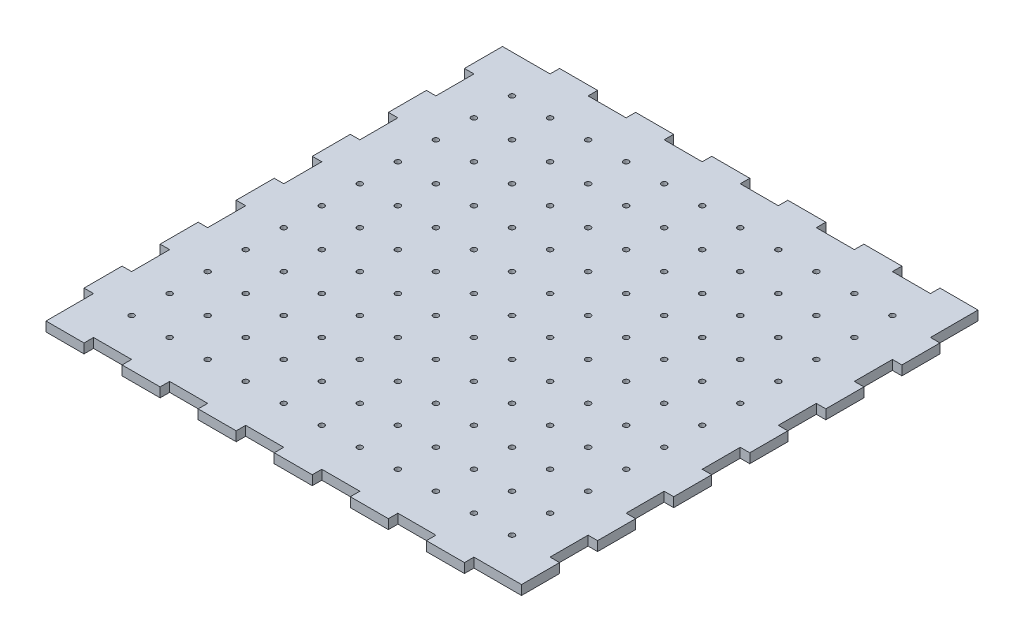
from build123d import *

# Parameters (mm, degrees)
SKETCH1_R           = 1.7907
BOSS_EXTRUDE1_DEPTH = 6.35


with BuildPart() as part:
    # Sketch1 → Boss-Extrude1 (new body)
    with BuildSketch(Plane(origin=(0, 0, 0), x_dir=(1, 0, 0), z_dir=(0, 1, 0))):
        Polygon((-65.292450766, -101.6), (-39.892450766, -101.6), (-39.892450766, -107.95), (-14.492450766, -107.95), (-14.492450766, -101.6), (10.907549234, -101.6), (10.907549234, -107.95), (36.307549234, -107.95), (36.307549234, -101.6), (61.707549234, -101.6), (61.707549234, -107.95), (87.107549234, -107.95), (87.107549234, -101.6), (112.507549234, -101.6), (112.507549234, -107.95), (137.907549234, -107.95), (137.907549234, -101.6), (163.307549234, -101.6), (163.307549234, -107.95), (188.707549234, -107.95), (188.707549234, -101.6), (220.457549234, -101.6), (220.457549234, -76.2), (214.107549234, -76.2), (214.107549234, -50.8), (220.457549234, -50.8), (220.457549234, -25.4), (214.107549234, -25.4), (214.107549234, 0), (220.457549234, 0), (220.457549234, 25.4), (214.107549234, 25.4), (214.107549234, 50.8), (220.457549234, 50.8), (220.457549234, 76.2), (214.107549234, 76.2), (214.107549234, 101.6), (220.457549234, 101.6), (220.457549234, 127), (214.107549234, 127), (214.107549234, 152.4), (220.457549234, 152.4), (220.457549234, 177.8), (214.107549234, 177.8), (214.107549234, 209.55), (188.707549234, 209.55), (188.707549234, 203.2), (163.307549234, 203.2), (163.307549234, 209.55), (137.907549234, 209.55), (137.907549234, 203.2), (112.507549234, 203.2), (112.507549234, 209.55), (87.107549234, 209.55), (87.107549234, 203.2), (61.707549234, 203.2), (61.707549234, 209.55), (36.307549234, 209.55), (36.307549234, 203.2), (10.907549234, 203.2), (10.907549234, 209.55), (-14.492450766, 209.55), (-14.492450766, 203.2), (-39.892450766, 203.2), (-39.892450766, 209.55), (-65.292450766, 209.55), (-65.292450766, 203.2), (-97.042450766, 203.2), (-97.042450766, 177.8), (-90.692450766, 177.8), (-90.692450766, 152.4), (-97.042450766, 152.4), (-97.042450766, 127), (-90.692450766, 127), (-90.692450766, 101.6), (-97.042450766, 101.6), (-97.042450766, 76.2), (-90.692450766, 76.2), (-90.692450766, 50.8), (-97.042450766, 50.8), (-97.042450766, 25.4), (-90.692450766, 25.4), (-90.692450766, 0), (-97.042450766, 0), (-97.042450766, -25.4), (-90.692450766, -25.4), (-90.692450766, -50.8), (-97.042450766, -50.8), (-97.042450766, -76.2), (-90.692450766, -76.2), (-90.692450766, -107.95), (-65.292450766, -107.95), align=None)
        with Locations(Location((-65.292450766, -76.2, 0), (0, 0, 270))):
            Circle(SKETCH1_R, mode=Mode.SUBTRACT)
        with Locations(Location((-39.892450766, -76.2, 0), (0, 0, 270))):
            Circle(SKETCH1_R, mode=Mode.SUBTRACT)
        with Locations(Location((-14.492450766, -76.2, 0), (0, 0, 270))):
            Circle(SKETCH1_R, mode=Mode.SUBTRACT)
        with Locations(Location((10.907549234, -76.2, 0), (0, 0, 270))):
            Circle(SKETCH1_R, mode=Mode.SUBTRACT)
        with Locations(Location((36.307549234, -76.2, 0), (0, 0, 270))):
            Circle(SKETCH1_R, mode=Mode.SUBTRACT)
        with Locations(Location((61.707549234, -76.2, 0), (0, 0, 270))):
            Circle(SKETCH1_R, mode=Mode.SUBTRACT)
        with Locations(Location((87.107549234, -76.2, 0), (0, 0, 270))):
            Circle(SKETCH1_R, mode=Mode.SUBTRACT)
        with Locations(Location((112.507549234, -76.2, 0), (0, 0, 270))):
            Circle(SKETCH1_R, mode=Mode.SUBTRACT)
        with Locations(Location((137.907549234, -76.2, 0), (0, 0, 270))):
            Circle(SKETCH1_R, mode=Mode.SUBTRACT)
        with Locations(Location((163.307549234, -76.2, 0), (0, 0, 270))):
            Circle(SKETCH1_R, mode=Mode.SUBTRACT)
        with Locations(Location((188.707549234, -76.2, 0), (0, 0, 270))):
            Circle(SKETCH1_R, mode=Mode.SUBTRACT)
        with Locations(Location((-65.292450766, -50.8, 0), (0, 0, 270))):
            Circle(SKETCH1_R, mode=Mode.SUBTRACT)
        with Locations(Location((-65.292450766, -25.4, 0), (0, 0, 270))):
            Circle(SKETCH1_R, mode=Mode.SUBTRACT)
        with Locations(Location((-65.292450766, 0, 0), (0, 0, 270))):
            Circle(SKETCH1_R, mode=Mode.SUBTRACT)
        with Locations(Location((-65.292450766, 25.4, 0), (0, 0, 270))):
            Circle(SKETCH1_R, mode=Mode.SUBTRACT)
        with Locations(Location((-65.292450766, 50.8, 0), (0, 0, 270))):
            Circle(SKETCH1_R, mode=Mode.SUBTRACT)
        with Locations(Location((-65.292450766, 76.2, 0), (0, 0, 270))):
            Circle(SKETCH1_R, mode=Mode.SUBTRACT)
        with Locations(Location((-65.292450766, 101.6, 0), (0, 0, 270))):
            Circle(SKETCH1_R, mode=Mode.SUBTRACT)
        with Locations(Location((-65.292450766, 127, 0), (0, 0, 270))):
            Circle(SKETCH1_R, mode=Mode.SUBTRACT)
        with Locations(Location((-65.292450766, 152.4, 0), (0, 0, 270))):
            Circle(SKETCH1_R, mode=Mode.SUBTRACT)
        with Locations(Location((-65.292450766, 177.8, 0), (0, 0, 270))):
            Circle(SKETCH1_R, mode=Mode.SUBTRACT)
        with Locations(Location((-39.892450766, -50.8, 0), (0, 0, 270))):
            Circle(SKETCH1_R, mode=Mode.SUBTRACT)
        with Locations(Location((-14.492450766, -50.8, 0), (0, 0, 270))):
            Circle(SKETCH1_R, mode=Mode.SUBTRACT)
        with Locations(Location((10.907549234, -50.8, 0), (0, 0, 270))):
            Circle(SKETCH1_R, mode=Mode.SUBTRACT)
        with Locations(Location((36.307549234, -50.8, 0), (0, 0, 270))):
            Circle(SKETCH1_R, mode=Mode.SUBTRACT)
        with Locations(Location((61.707549234, -50.8, 0), (0, 0, 270))):
            Circle(SKETCH1_R, mode=Mode.SUBTRACT)
        with Locations(Location((87.107549234, -50.8, 0), (0, 0, 270))):
            Circle(SKETCH1_R, mode=Mode.SUBTRACT)
        with Locations(Location((112.507549234, -50.8, 0), (0, 0, 270))):
            Circle(SKETCH1_R, mode=Mode.SUBTRACT)
        with Locations(Location((137.907549234, -50.8, 0), (0, 0, 270))):
            Circle(SKETCH1_R, mode=Mode.SUBTRACT)
        with Locations(Location((163.307549234, -50.8, 0), (0, 0, 270))):
            Circle(SKETCH1_R, mode=Mode.SUBTRACT)
        with Locations(Location((188.707549234, -50.8, 0), (0, 0, 270))):
            Circle(SKETCH1_R, mode=Mode.SUBTRACT)
        with Locations(Location((-39.892450766, -25.4, 0), (0, 0, 270))):
            Circle(SKETCH1_R, mode=Mode.SUBTRACT)
        with Locations(Location((-14.492450766, -25.4, 0), (0, 0, 270))):
            Circle(SKETCH1_R, mode=Mode.SUBTRACT)
        with Locations(Location((10.907549234, -25.4, 0), (0, 0, 270))):
            Circle(SKETCH1_R, mode=Mode.SUBTRACT)
        with Locations(Location((36.307549234, -25.4, 0), (0, 0, 270))):
            Circle(SKETCH1_R, mode=Mode.SUBTRACT)
        with Locations(Location((61.707549234, -25.4, 0), (0, 0, 270))):
            Circle(SKETCH1_R, mode=Mode.SUBTRACT)
        with Locations(Location((87.107549234, -25.4, 0), (0, 0, 270))):
            Circle(SKETCH1_R, mode=Mode.SUBTRACT)
        with Locations(Location((112.507549234, -25.4, 0), (0, 0, 270))):
            Circle(SKETCH1_R, mode=Mode.SUBTRACT)
        with Locations(Location((137.907549234, -25.4, 0), (0, 0, 270))):
            Circle(SKETCH1_R, mode=Mode.SUBTRACT)
        with Locations(Location((163.307549234, -25.4, 0), (0, 0, 270))):
            Circle(SKETCH1_R, mode=Mode.SUBTRACT)
        with Locations(Location((188.707549234, -25.4, 0), (0, 0, 270))):
            Circle(SKETCH1_R, mode=Mode.SUBTRACT)
        with Locations(Location((-39.892450766, 0, 0), (0, 0, 270))):
            Circle(SKETCH1_R, mode=Mode.SUBTRACT)
        with Locations(Location((-14.492450766, 0, 0), (0, 0, 270))):
            Circle(SKETCH1_R, mode=Mode.SUBTRACT)
        with Locations(Location((10.907549234, 0, 0), (0, 0, 270))):
            Circle(SKETCH1_R, mode=Mode.SUBTRACT)
        with Locations(Location((36.307549234, 0, 0), (0, 0, 270))):
            Circle(SKETCH1_R, mode=Mode.SUBTRACT)
        with Locations(Location((61.707549234, 0, 0), (0, 0, 270))):
            Circle(SKETCH1_R, mode=Mode.SUBTRACT)
        with Locations(Location((87.107549234, 0, 0), (0, 0, 270))):
            Circle(SKETCH1_R, mode=Mode.SUBTRACT)
        with Locations(Location((112.507549234, 0, 0), (0, 0, 270))):
            Circle(SKETCH1_R, mode=Mode.SUBTRACT)
        with Locations(Location((137.907549234, 0, 0), (0, 0, 270))):
            Circle(SKETCH1_R, mode=Mode.SUBTRACT)
        with Locations(Location((163.307549234, 0, 0), (0, 0, 270))):
            Circle(SKETCH1_R, mode=Mode.SUBTRACT)
        with Locations(Location((188.707549234, 0, 0), (0, 0, 270))):
            Circle(SKETCH1_R, mode=Mode.SUBTRACT)
        with Locations(Location((-39.892450766, 25.4, 0), (0, 0, 270))):
            Circle(SKETCH1_R, mode=Mode.SUBTRACT)
        with Locations(Location((-14.492450766, 25.4, 0), (0, 0, 270))):
            Circle(SKETCH1_R, mode=Mode.SUBTRACT)
        with Locations(Location((10.907549234, 25.4, 0), (0, 0, 270))):
            Circle(SKETCH1_R, mode=Mode.SUBTRACT)
        with Locations(Location((36.307549234, 25.4, 0), (0, 0, 270))):
            Circle(SKETCH1_R, mode=Mode.SUBTRACT)
        with Locations(Location((61.707549234, 25.4, 0), (0, 0, 270))):
            Circle(SKETCH1_R, mode=Mode.SUBTRACT)
        with Locations(Location((87.107549234, 25.4, 0), (0, 0, 270))):
            Circle(SKETCH1_R, mode=Mode.SUBTRACT)
        with Locations(Location((112.507549234, 25.4, 0), (0, 0, 270))):
            Circle(SKETCH1_R, mode=Mode.SUBTRACT)
        with Locations(Location((137.907549234, 25.4, 0), (0, 0, 270))):
            Circle(SKETCH1_R, mode=Mode.SUBTRACT)
        with Locations(Location((163.307549234, 25.4, 0), (0, 0, 270))):
            Circle(SKETCH1_R, mode=Mode.SUBTRACT)
        with Locations(Location((188.707549234, 25.4, 0), (0, 0, 270))):
            Circle(SKETCH1_R, mode=Mode.SUBTRACT)
        with Locations(Location((-39.892450766, 50.8, 0), (0, 0, 270))):
            Circle(SKETCH1_R, mode=Mode.SUBTRACT)
        with Locations(Location((-14.492450766, 50.8, 0), (0, 0, 270))):
            Circle(SKETCH1_R, mode=Mode.SUBTRACT)
        with Locations(Location((10.907549234, 50.8, 0), (0, 0, 270))):
            Circle(SKETCH1_R, mode=Mode.SUBTRACT)
        with Locations(Location((36.307549234, 50.8, 0), (0, 0, 270))):
            Circle(SKETCH1_R, mode=Mode.SUBTRACT)
        with Locations(Location((61.707549234, 50.8, 0), (0, 0, 270))):
            Circle(SKETCH1_R, mode=Mode.SUBTRACT)
        with Locations(Location((87.107549234, 50.8, 0), (0, 0, 270))):
            Circle(SKETCH1_R, mode=Mode.SUBTRACT)
        with Locations(Location((112.507549234, 50.8, 0), (0, 0, 270))):
            Circle(SKETCH1_R, mode=Mode.SUBTRACT)
        with Locations(Location((137.907549234, 50.8, 0), (0, 0, 270))):
            Circle(SKETCH1_R, mode=Mode.SUBTRACT)
        with Locations(Location((163.307549234, 50.8, 0), (0, 0, 270))):
            Circle(SKETCH1_R, mode=Mode.SUBTRACT)
        with Locations(Location((188.707549234, 50.8, 0), (0, 0, 270))):
            Circle(SKETCH1_R, mode=Mode.SUBTRACT)
        with Locations(Location((-39.892450766, 76.2, 0), (0, 0, 270))):
            Circle(SKETCH1_R, mode=Mode.SUBTRACT)
        with Locations(Location((-14.492450766, 76.2, 0), (0, 0, 270))):
            Circle(SKETCH1_R, mode=Mode.SUBTRACT)
        with Locations(Location((10.907549234, 76.2, 0), (0, 0, 270))):
            Circle(SKETCH1_R, mode=Mode.SUBTRACT)
        with Locations(Location((36.307549234, 76.2, 0), (0, 0, 270))):
            Circle(SKETCH1_R, mode=Mode.SUBTRACT)
        with Locations(Location((61.707549234, 76.2, 0), (0, 0, 270))):
            Circle(SKETCH1_R, mode=Mode.SUBTRACT)
        with Locations(Location((87.107549234, 76.2, 0), (0, 0, 270))):
            Circle(SKETCH1_R, mode=Mode.SUBTRACT)
        with Locations(Location((112.507549234, 76.2, 0), (0, 0, 270))):
            Circle(SKETCH1_R, mode=Mode.SUBTRACT)
        with Locations(Location((137.907549234, 76.2, 0), (0, 0, 270))):
            Circle(SKETCH1_R, mode=Mode.SUBTRACT)
        with Locations(Location((163.307549234, 76.2, 0), (0, 0, 270))):
            Circle(SKETCH1_R, mode=Mode.SUBTRACT)
        with Locations(Location((188.707549234, 76.2, 0), (0, 0, 270))):
            Circle(SKETCH1_R, mode=Mode.SUBTRACT)
        with Locations(Location((-39.892450766, 101.6, 0), (0, 0, 270))):
            Circle(SKETCH1_R, mode=Mode.SUBTRACT)
        with Locations(Location((-14.492450766, 101.6, 0), (0, 0, 270))):
            Circle(SKETCH1_R, mode=Mode.SUBTRACT)
        with Locations(Location((10.907549234, 101.6, 0), (0, 0, 270))):
            Circle(SKETCH1_R, mode=Mode.SUBTRACT)
        with Locations(Location((36.307549234, 101.6, 0), (0, 0, 270))):
            Circle(SKETCH1_R, mode=Mode.SUBTRACT)
        with Locations(Location((61.707549234, 101.6, 0), (0, 0, 270))):
            Circle(SKETCH1_R, mode=Mode.SUBTRACT)
        with Locations(Location((87.107549234, 101.6, 0), (0, 0, 270))):
            Circle(SKETCH1_R, mode=Mode.SUBTRACT)
        with Locations(Location((112.507549234, 101.6, 0), (0, 0, 270))):
            Circle(SKETCH1_R, mode=Mode.SUBTRACT)
        with Locations(Location((137.907549234, 101.6, 0), (0, 0, 270))):
            Circle(SKETCH1_R, mode=Mode.SUBTRACT)
        with Locations(Location((163.307549234, 101.6, 0), (0, 0, 270))):
            Circle(SKETCH1_R, mode=Mode.SUBTRACT)
        with Locations(Location((188.707549234, 101.6, 0), (0, 0, 270))):
            Circle(SKETCH1_R, mode=Mode.SUBTRACT)
        with Locations(Location((-39.892450766, 127, 0), (0, 0, 270))):
            Circle(SKETCH1_R, mode=Mode.SUBTRACT)
        with Locations(Location((-14.492450766, 127, 0), (0, 0, 270))):
            Circle(SKETCH1_R, mode=Mode.SUBTRACT)
        with Locations(Location((10.907549234, 127, 0), (0, 0, 270))):
            Circle(SKETCH1_R, mode=Mode.SUBTRACT)
        with Locations(Location((36.307549234, 127, 0), (0, 0, 270))):
            Circle(SKETCH1_R, mode=Mode.SUBTRACT)
        with Locations(Location((61.707549234, 127, 0), (0, 0, 270))):
            Circle(SKETCH1_R, mode=Mode.SUBTRACT)
        with Locations(Location((87.107549234, 127, 0), (0, 0, 270))):
            Circle(SKETCH1_R, mode=Mode.SUBTRACT)
        with Locations(Location((112.507549234, 127, 0), (0, 0, 270))):
            Circle(SKETCH1_R, mode=Mode.SUBTRACT)
        with Locations(Location((137.907549234, 127, 0), (0, 0, 270))):
            Circle(SKETCH1_R, mode=Mode.SUBTRACT)
        with Locations(Location((163.307549234, 127, 0), (0, 0, 270))):
            Circle(SKETCH1_R, mode=Mode.SUBTRACT)
        with Locations(Location((188.707549234, 127, 0), (0, 0, 270))):
            Circle(SKETCH1_R, mode=Mode.SUBTRACT)
        with Locations(Location((-39.892450766, 152.4, 0), (0, 0, 270))):
            Circle(SKETCH1_R, mode=Mode.SUBTRACT)
        with Locations(Location((-14.492450766, 152.4, 0), (0, 0, 270))):
            Circle(SKETCH1_R, mode=Mode.SUBTRACT)
        with Locations(Location((10.907549234, 152.4, 0), (0, 0, 270))):
            Circle(SKETCH1_R, mode=Mode.SUBTRACT)
        with Locations(Location((36.307549234, 152.4, 0), (0, 0, 270))):
            Circle(SKETCH1_R, mode=Mode.SUBTRACT)
        with Locations(Location((61.707549234, 152.4, 0), (0, 0, 270))):
            Circle(SKETCH1_R, mode=Mode.SUBTRACT)
        with Locations(Location((87.107549234, 152.4, 0), (0, 0, 270))):
            Circle(SKETCH1_R, mode=Mode.SUBTRACT)
        with Locations(Location((112.507549234, 152.4, 0), (0, 0, 270))):
            Circle(SKETCH1_R, mode=Mode.SUBTRACT)
        with Locations(Location((137.907549234, 152.4, 0), (0, 0, 270))):
            Circle(SKETCH1_R, mode=Mode.SUBTRACT)
        with Locations(Location((163.307549234, 152.4, 0), (0, 0, 270))):
            Circle(SKETCH1_R, mode=Mode.SUBTRACT)
        with Locations(Location((188.707549234, 152.4, 0), (0, 0, 270))):
            Circle(SKETCH1_R, mode=Mode.SUBTRACT)
        with Locations(Location((-39.892450766, 177.8, 0), (0, 0, 270))):
            Circle(SKETCH1_R, mode=Mode.SUBTRACT)
        with Locations(Location((-14.492450766, 177.8, 0), (0, 0, 270))):
            Circle(SKETCH1_R, mode=Mode.SUBTRACT)
        with Locations(Location((10.907549234, 177.8, 0), (0, 0, 270))):
            Circle(SKETCH1_R, mode=Mode.SUBTRACT)
        with Locations(Location((36.307549234, 177.8, 0), (0, 0, 270))):
            Circle(SKETCH1_R, mode=Mode.SUBTRACT)
        with Locations(Location((61.707549234, 177.8, 0), (0, 0, 270))):
            Circle(SKETCH1_R, mode=Mode.SUBTRACT)
        with Locations(Location((87.107549234, 177.8, 0), (0, 0, 270))):
            Circle(SKETCH1_R, mode=Mode.SUBTRACT)
        with Locations(Location((112.507549234, 177.8, 0), (0, 0, 270))):
            Circle(SKETCH1_R, mode=Mode.SUBTRACT)
        with Locations(Location((137.907549234, 177.8, 0), (0, 0, 270))):
            Circle(SKETCH1_R, mode=Mode.SUBTRACT)
        with Locations(Location((163.307549234, 177.8, 0), (0, 0, 270))):
            Circle(SKETCH1_R, mode=Mode.SUBTRACT)
        with Locations(Location((188.707549234, 177.8, 0), (0, 0, 270))):
            Circle(SKETCH1_R, mode=Mode.SUBTRACT)
    extrude(amount=BOSS_EXTRUDE1_DEPTH)


solid = part.part
